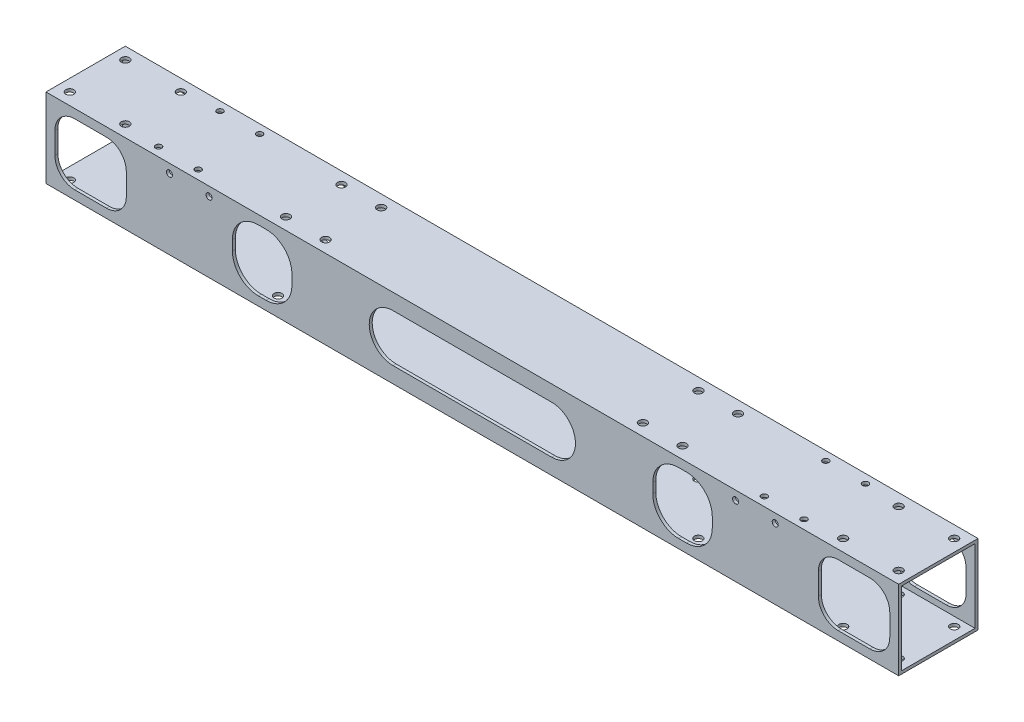
from build123d import *

# Parameters (mm, degrees)
SKETCH_1_W             = 40
SKETCH_1_H             = 40
SKETCH_1_W_2           = 37
SKETCH_1_H_2           = 37
EXTRUDE_1_DEPTH        = 215
CUT_EXTRUDE_1_DEPTH    = 40
SKETCH_3_R             = 2.025
CUT_EXTRUDE_2_DEPTH    = 50
SKETCH_5_R             = 2.025
CUT_EXTRUDE_3_DEPTH    = 30
SKETCH_6_W             = 30
SKETCH_6_H             = 31
CUT_EXTRUDE_4_DEPTH    = 54
FILLET_1_R             = 13
FILLET_1_OF_MIRROR_4_R = 13
SKETCH_8_R             = 2.025
CUT_EXTRUDE_5_DEPTH    = 3
SKETCH_9_R             = 2.025
CUT_EXTRUDE_6_DEPTH    = 10
CUT_EXTRUDE_7_DEPTH    = 220.60191256
SKETCH_12_R            = 1.525
CUT_EXTRUDE_8_DEPTH    = 60
SKETCH_13_R            = 1.525
CUT_EXTRUDE_9_DEPTH    = 60


with BuildPart() as part:
    # 草图1 → 凸台-拉伸1 (new, symmetric)
    with BuildSketch(Plane(origin=(0, 0, 0), x_dir=(0, 0, -1), z_dir=(1, 0, 0))):
        Rectangle(SKETCH_1_W, SKETCH_1_H)
        Rectangle(SKETCH_1_W_2, SKETCH_1_H_2, mode=Mode.SUBTRACT)
    extrude(amount=EXTRUDE_1_DEPTH, both=True)

    # 草图2 → 切除-拉伸1 (cut)
    with BuildSketch(Plane.XY.offset(20)):
        with BuildLine():
            Line((184.5, -15.5), (200.5, -15.5))
            ThreePointArc((200.5, -15.5), (207.571067812, -12.571067812), (210.5, -5.5))
            Line((210.5, -5.5), (210.5, 5.5))
            ThreePointArc((210.5, 5.5), (207.571067812, 12.571067812), (200.5, 15.5))
            Line((200.5, 15.5), (184.5, 15.5))
            ThreePointArc((184.5, 15.5), (177.428932188, 12.571067812), (174.5, 5.5))
            Line((174.5, 5.5), (174.5, -5.5))
            ThreePointArc((174.5, -5.5), (177.428932188, -12.571067812), (184.5, -15.5))
        make_face()
    cut_extrude_1 = extrude(amount=-CUT_EXTRUDE_1_DEPTH, mode=Mode.SUBTRACT)

    # 镜向1: 切除-拉伸1 across plane
    add(cut_extrude_1.mirror(Plane(origin=(0, 0, 0), x_dir=(0, 0, 1), z_dir=(1, 0, 0))), mode=Mode.SUBTRACT)

    # 草图3 → 切除-拉伸2 (cut)
    with BuildSketch(Plane(origin=(0, 20, 0), x_dir=(1, 0, 0), z_dir=(0, 1, 0))):
        with Locations((181, 14)):
            Circle(SKETCH_3_R)
        with Locations((209, 14)):
            Circle(SKETCH_3_R)
        with Locations((181, -14)):
            Circle(SKETCH_3_R)
        with Locations((209, -14)):
            Circle(SKETCH_3_R)
    cut_extrude_2 = extrude(amount=-CUT_EXTRUDE_2_DEPTH, mode=Mode.SUBTRACT)

    # 镜向2: 切除-拉伸2 across plane
    add(cut_extrude_2.mirror(Plane(origin=(0, 0, 0), x_dir=(0, 0, 1), z_dir=(1, 0, 0))), mode=Mode.SUBTRACT)

    # 草图5 → 切除-拉伸3 (cut)
    with BuildSketch(Plane.XZ.offset(20)):
        with Locations((-106, -12)):
            Circle(SKETCH_5_R)
        with Locations((-106, 12)):
            Circle(SKETCH_5_R)
    cut_extrude_3 = extrude(amount=-CUT_EXTRUDE_3_DEPTH, mode=Mode.SUBTRACT)

    # 镜向3: 切除-拉伸3 across plane
    add(cut_extrude_3.mirror(Plane(origin=(0, 0, 0), x_dir=(0, 0, 1), z_dir=(1, 0, 0))), mode=Mode.SUBTRACT)

    # 草图6 → 切除-拉伸4 (cut)
    with BuildSketch(Plane.XY.offset(20)):
        with Locations((-106, 0)):
            Rectangle(SKETCH_6_W, SKETCH_6_H)
    cut_extrude_4 = extrude(amount=-CUT_EXTRUDE_4_DEPTH, mode=Mode.SUBTRACT)

    # 圆角1
    fillet_1_edges = [part.edges().sort_by_distance(p)[0] for p in [
        (-91, -15.5, 19.25),
        (-121, 15.5, 19.25),
        (-91, 15.5, 19.25),
        (-121, -15.5, 19.25),
        (-121, 15.5, -19.25),
        (-91, 15.5, -19.25),
        (-91, -15.5, -19.25),
        (-121, -15.5, -19.25),
    ]]
    fillet(fillet_1_edges, radius=FILLET_1_R)

    # 镜向4: 切除-拉伸4 across plane
    add(cut_extrude_4.mirror(Plane(origin=(0, 0, 0), x_dir=(0, 0, 1), z_dir=(1, 0, 0))), mode=Mode.SUBTRACT)

    # 圆角1 of 镜向4
    fillet_1_of_mirror_4_edges = [part.edges().sort_by_distance(p)[0] for p in [
        (91, -15.5, 19.25),
        (121, 15.5, 19.25),
        (91, 15.5, 19.25),
        (121, -15.5, 19.25),
        (121, 15.5, -19.25),
        (91, 15.5, -19.25),
        (91, -15.5, -19.25),
        (121, -15.5, -19.25),
    ]]
    fillet(fillet_1_of_mirror_4_edges, radius=FILLET_1_OF_MIRROR_4_R)

    # 草图8 → 切除-拉伸5 (cut)
    with BuildSketch(Plane(origin=(0, 20, 0), x_dir=(1, 0, 0), z_dir=(0, 1, 0))):
        with Locations((-100, 14)):
            Circle(SKETCH_8_R)
        with Locations((-80, 14)):
            Circle(SKETCH_8_R)
        with Locations((-100, -14)):
            Circle(SKETCH_8_R)
        with Locations((-80, -14)):
            Circle(SKETCH_8_R)
        with Locations((80, -14)):
            Circle(SKETCH_8_R)
        with Locations((100, -14)):
            Circle(SKETCH_8_R)
        with Locations((80, 14)):
            Circle(SKETCH_8_R)
        with Locations((100, 14)):
            Circle(SKETCH_8_R)
    extrude(amount=-CUT_EXTRUDE_5_DEPTH, mode=Mode.SUBTRACT)

    # 草图9 → 切除-拉伸6 (cut)
    with BuildSketch(Plane(origin=(0, -18.5, 0), x_dir=(1, 0, 0), z_dir=(0, 1, 0))):
        with Locations((-80, -14)):
            Circle(SKETCH_9_R)
        with Locations((-80, 14)):
            Circle(SKETCH_9_R)
        with Locations((80, -14)):
            Circle(SKETCH_9_R)
        with Locations((80, 14)):
            Circle(SKETCH_9_R)
    extrude(amount=-CUT_EXTRUDE_6_DEPTH, mode=Mode.SUBTRACT)

    # 草图10 → 切除-拉伸7 (cut, through all)
    with BuildSketch(Plane.XY.offset(20)):
        with BuildLine():
            Line((-40, 12), (40, 12))
            ThreePointArc((40, 12), (52, 0), (40, -12))
            Line((40, -12), (-40, -12))
            ThreePointArc((-40, -12), (-52, 0), (-40, 12))
        make_face()
    extrude(amount=-CUT_EXTRUDE_7_DEPTH, mode=Mode.SUBTRACT)

    # 草图12 → 切除-拉伸8 (cut)
    with BuildSketch(Plane.XY.offset(20)):
        with Locations((-152.75, 15.5)):
            Circle(SKETCH_12_R)
        with Locations((-132.75, 15.5)):
            Circle(SKETCH_12_R)
    cut_extrude_8 = extrude(amount=-CUT_EXTRUDE_8_DEPTH, mode=Mode.SUBTRACT)

    # 草图13 → 切除-拉伸9 (cut)
    with BuildSketch(Plane(origin=(0, 20, 0), x_dir=(1, 0, 0), z_dir=(0, 1, 0))):
        with Locations((-162.75, -15.5)):
            Circle(SKETCH_13_R)
        with Locations((-142.75, -15.5)):
            Circle(SKETCH_13_R)
        with Locations((-142.75, 15.5)):
            Circle(SKETCH_13_R)
        with Locations((-162.75, 15.5)):
            Circle(SKETCH_13_R)
    cut_extrude_9 = extrude(amount=-CUT_EXTRUDE_9_DEPTH, mode=Mode.SUBTRACT)

    # 镜向5: 切除-拉伸8, 切除-拉伸9 across plane
    add(cut_extrude_8.mirror(Plane(origin=(0, 0, 0), x_dir=(0, 0, 1), z_dir=(1, 0, 0))), mode=Mode.SUBTRACT)
    add(cut_extrude_9.mirror(Plane(origin=(0, 0, 0), x_dir=(0, 0, 1), z_dir=(1, 0, 0))), mode=Mode.SUBTRACT)


solid = part.part
